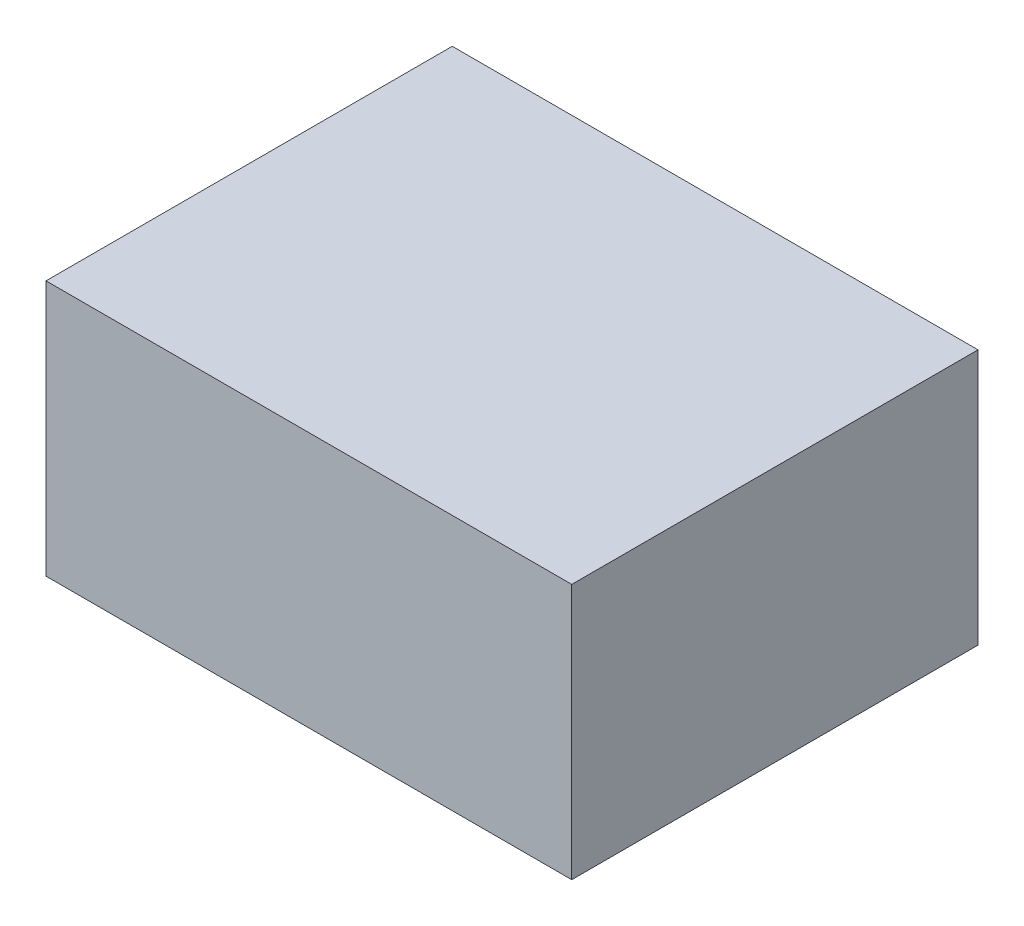
from build123d import *

# Parameters (mm, degrees)
SKETCH1_W           = 31.326257163
SKETCH1_H           = 24.206653262
BOSS_EXTRUDE1_DEPTH = 15.24


with BuildPart() as part:
    # Sketch1 → Boss-Extrude1 (new body)
    with BuildSketch(Plane(origin=(0, 0, 0), x_dir=(1, 0, 0), z_dir=(0, 1, 0))):
        with Locations((15.663128582, -12.103326631)):
            Rectangle(SKETCH1_W, SKETCH1_H)
    extrude(amount=BOSS_EXTRUDE1_DEPTH)


solid = part.part
